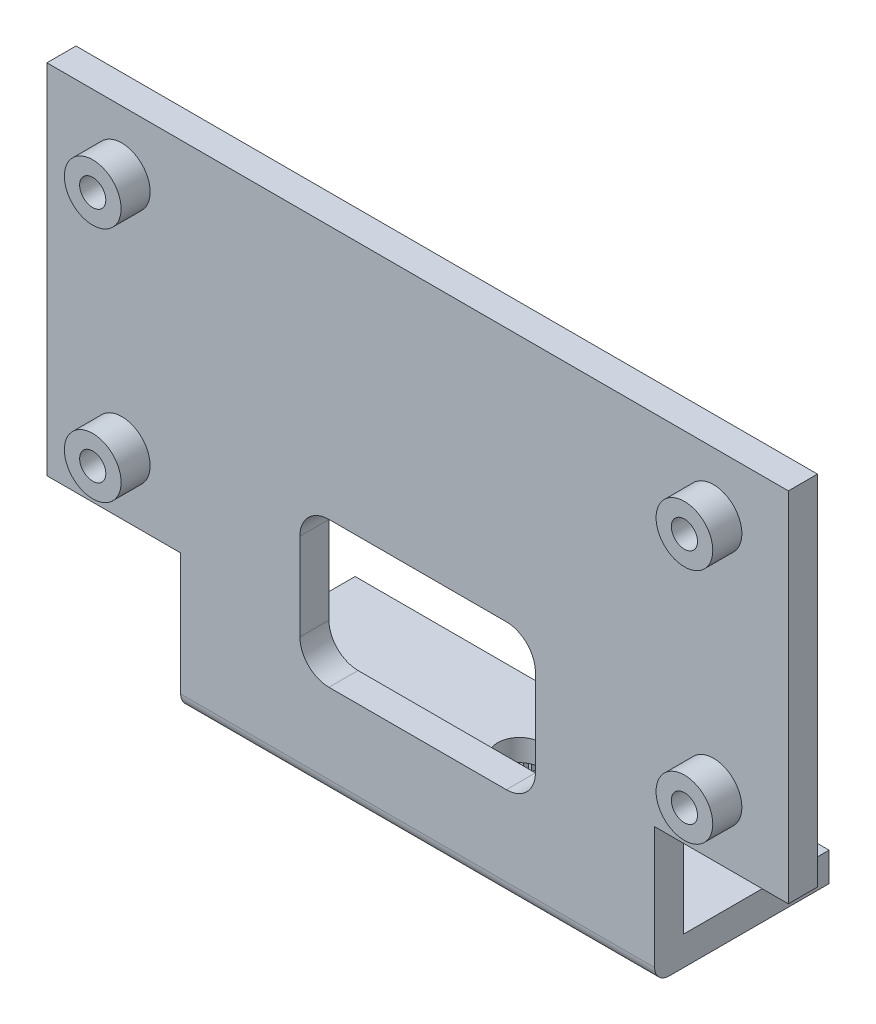
from build123d import *

# Parameters (mm, degrees)
SKETCH1_W               = 51
SKETCH1_H               = 12
BRACKET_SIZE_DEPTH      = 34
SIDE_PROFILE_DEPTH      = 45.161634934
SIDE_PROFILE_DEPTH_BACK = 45.161634934
SKETCH2_W               = 10
SKETCH2_H               = 32
FILLET1_R               = 1
SKETCH3_W               = 9.2
SKETCH3_H               = 9.4
BASE_TRIM_DEPTH         = 45.161634934
WIRE_REILEF_HOLE_DEPTH  = 45.161634934
SKETCH5_R               = 1.95
SPACER_DEPTH            = 2
M1_6_CLEARANCE_HOLE1_D  = 1.8
SKETCH8_R               = 3.4
SERVO_SPACER_DEPTH      = 3
SPLINE_TOOTH_DEPTH      = 3.5
SPLINE_COUNT            = 36
M2_CLEARANCE_HOLE1_D    = 3


with BuildPart() as part:
    # Sketch1 → Bracket Size (new body)
    with BuildSketch(Plane(origin=(0, 0, 0), x_dir=(1, 0, 0), z_dir=(0, 1, 0))):
        with Locations((0, 6)):
            Rectangle(SKETCH1_W, SKETCH1_H)
    extrude(amount=BRACKET_SIZE_DEPTH)

    # Sketch2 → Side Profile (cut, two sides: drawn at the far end of the back side and taken through both)
    with BuildSketch(Plane(origin=(0, 0, 0), x_dir=(0, 0, -1), z_dir=(1, 0, 0)).offset(-SIDE_PROFILE_DEPTH_BACK)):
        with Locations((7, 18)):
            Rectangle(SKETCH2_W, SKETCH2_H)
    extrude(amount=SIDE_PROFILE_DEPTH + SIDE_PROFILE_DEPTH_BACK, mode=Mode.SUBTRACT)

    # Fillet1
    fillet1_edges = [part.edges().sort_by_distance(p)[0] for p in [
        (0, 0, 0),
    ]]
    fillet(fillet1_edges, radius=FILLET1_R)

    # Sketch3 → Base Trim (cut, through all)
    with BuildSketch(Plane.XY):
        with Locations((20.9, 4.7)):
            Rectangle(SKETCH3_W, SKETCH3_H)
        with Locations((-20.9, 4.7)):
            Rectangle(SKETCH3_W, SKETCH3_H)
    extrude(amount=-BASE_TRIM_DEPTH, mode=Mode.SUBTRACT)

    # Sketch4 → Wire Reilef Hole (cut, through all)
    with BuildSketch(Plane.XY):
        with BuildLine():
            Line((-6.1, 16.5), (6.1, 16.5))
            ThreePointArc((6.1, 16.5), (7.514213562, 15.914213562), (8.1, 14.5))
            Line((8.1, 14.5), (8.1, 8.5))
            ThreePointArc((8.1, 8.5), (7.514213562, 7.085786438), (6.1, 6.5))
            Line((6.1, 6.5), (-6.1, 6.5))
            ThreePointArc((-6.1, 6.5), (-7.514213562, 7.085786438), (-8.1, 8.5))
            Line((-8.1, 8.5), (-8.1, 14.5))
            ThreePointArc((-8.1, 14.5), (-7.514213562, 15.914213562), (-6.1, 16.5))
        make_face()
    extrude(amount=-WIRE_REILEF_HOLE_DEPTH, mode=Mode.SUBTRACT)

    # Sketch5 → Spacer (add)
    with BuildSketch(Plane.XY):
        with Locations(Location((-20.35, 29.85, 0), (0, 0, 180))):
            Circle(SKETCH5_R)
    spacer = extrude(amount=SPACER_DEPTH)

    # M1.6 Clearance Hole1 (through all)
    with Locations(Plane.XY.offset(2)):
        with Locations((-20.35, 29.85)):
            m1_6_clearance_hole1 = Hole(M1_6_CLEARANCE_HOLE1_D / 2)

    # Spacer Pattern: Spacer, M1.6 Clearance Hole1 at 3 more places
    with Locations((0, -16.3, 0), (40.7, -16.3, 0), (40.7, 0, 0)):
        add(spacer)
        add(m1_6_clearance_hole1, mode=Mode.SUBTRACT)

    # Sketch8 → Servo Spacer (add)
    with BuildSketch(Plane(origin=(0, 0, 0), x_dir=(1, 0, 0), z_dir=(0, 1, 0))):
        with Locations(Location((0, 7, 0), (0, 0, 270))):
            Circle(SKETCH8_R)
    extrude(amount=-SERVO_SPACER_DEPTH)

    # Sketch9 → Spline Tooth (cut)
    with BuildSketch(Plane.XZ.offset(3)):
        Polygon((0.39070839, -4.78418261), (0.217889353, -4.509513302), (0, -4.750000055), (0, -7), align=None)
    spline_tooth = extrude(amount=-SPLINE_TOOTH_DEPTH, mode=Mode.SUBTRACT)

    # Spline: Spline Tooth ×36 about axis
    spline_axis = Axis((0, 0, -7), (0, 1, 0))
    for i in range(1, SPLINE_COUNT):
        add(spline_tooth.rotate(spline_axis, i * 360 / SPLINE_COUNT), mode=Mode.SUBTRACT)

    # M2 Clearance Hole1 (through all)
    with Locations(Plane.XZ):
        with Locations((0, -7)):
            Hole(M2_CLEARANCE_HOLE1_D / 2)


solid = part.part
